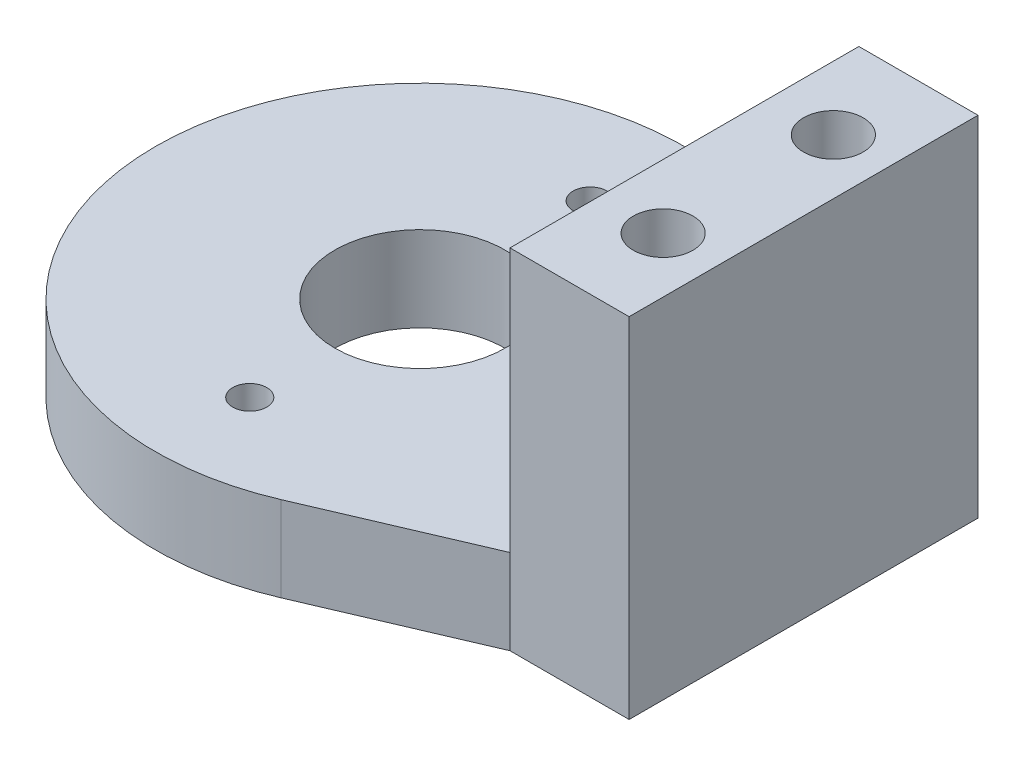
from build123d import *

# Parameters (mm, degrees)
SKETCH1_W               = 7
SKETCH1_H               = 20.5
MOUNTINGBASE_DEPTH      = 20.50030868
SKETCH2_R               = 1.75
MOUNTINGHOLES_DEPTH     = 30.824698757
HORNTAB_DEPTH           = 5
SKETCH4_R               = 1
SKETCH4_R_2             = 5
HORNMOUNTINGHOLES_DEPTH = 5


with BuildPart() as part:
    # Sketch1 → mountingBase (new body)
    with BuildSketch(Plane(origin=(0, 0, 0), x_dir=(1, 0, 0), z_dir=(0, 1, 0))):
        with Locations((3.5, -10.25)):
            Rectangle(SKETCH1_W, SKETCH1_H)
    extrude(amount=MOUNTINGBASE_DEPTH)

    # Sketch2 → mountingHoles (cut, through all)
    with BuildSketch(Plane(origin=(0, 20.50030868, 0), x_dir=(1, 0, 0), z_dir=(0, 1, 0))):
        with Locations(Location((3.75, -5.25, 0), (0, 0, 270))):
            Circle(SKETCH2_R)
        with Locations(Location((3.75, -15.25, 0), (0, 0, 90))):
            Circle(SKETCH2_R)
    extrude(amount=-MOUNTINGHOLES_DEPTH, mode=Mode.SUBTRACT)

    # Sketch3 → hornTab (add)
    with BuildSketch(Plane(origin=(0, 0, 0), x_dir=(1, 0, 0), z_dir=(0, 1, 0))):
        with BuildLine():
            Line((0, 0), (-9.422358224, 4.035054584))
            ThreePointArc((-9.422358224, 4.035054584), (-31.07965246, -10.25), (-9.422358224, -24.535054584))
            Line((-9.422358224, -24.535054584), (0, -20.5))
            Line((0, -20.5), (0, 0))
        make_face()
    extrude(amount=HORNTAB_DEPTH)

    # Sketch4 → hornMountingHoles (cut)
    with BuildSketch(Plane(origin=(0, 5, 0), x_dir=(1, 0, 0), z_dir=(0, 1, 0))):
        with Locations(Location((-15.53982623, -0.25, 0), (0, 0, 270))):
            Circle(SKETCH4_R)
        with Locations(Location((-15.53982623, -20.25, 0), (0, 0, 90))):
            Circle(SKETCH4_R)
        with Locations(Location((-15.53982623, -10.25, 0), (0, 0, 270))):
            Circle(SKETCH4_R_2)
    extrude(amount=-HORNMOUNTINGHOLES_DEPTH, mode=Mode.SUBTRACT)


solid = part.part
